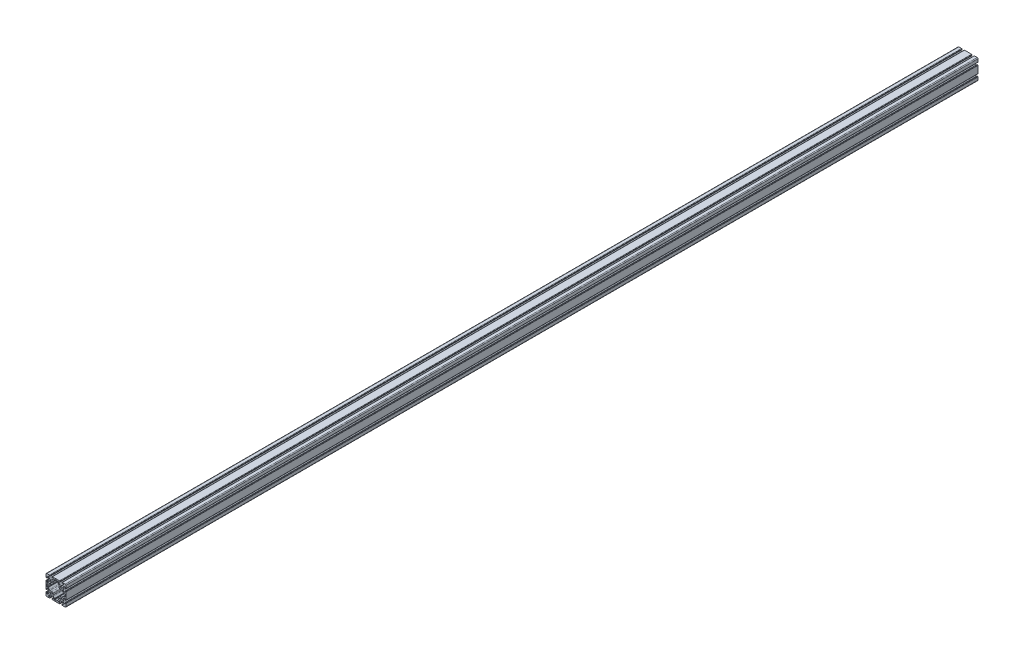
from build123d import *

# Parameters (mm, degrees)
SKETCH1_R      = 3.4
EXTRUDE1_DEPTH = 3657.6


with BuildPart() as part:
    # Sketch1 → Extrude1 (new body)
    with BuildSketch(Plane.XY):
        with BuildLine():
            Line((29.091242789, 26.036541495), (33.082657296, 30.027956002))
            ThreePointArc((33.082657296, 30.027956002), (33.329219041, 30.192703293), (33.62005845, 30.250554848))
            Line((33.62005845, 30.250554848), (33.955571436, 30.250554848))
            ThreePointArc((33.955571436, 30.250554848), (35.065729082, 29.790712494), (35.525571436, 28.680554848))
            Line((35.525571436, 28.680554848), (35.525571436, 25.777866899))
            ThreePointArc((35.525571436, 25.777866899), (35.985413789, 24.667709253), (37.095571436, 24.207866899))
            Line((37.095571436, 24.207866899), (38.43, 24.207866899))
            ThreePointArc((38.43, 24.207866899), (39.540157646, 24.667709253), (40, 25.777866899))
            Line((40, 25.777866899), (40, 32.933852749))
            Line((40, 32.933852749), (40, 36.83))
            ThreePointArc((40, 36.83), (39.071528496, 39.071528496), (36.83, 40))
            Line((36.83, 40), (25.540851266, 40))
            ThreePointArc((25.540851266, 40), (24.43069362, 39.540157646), (23.970851266, 38.43))
            Line((23.970851266, 38.43), (23.970851266, 37.249043598))
            ThreePointArc((23.970851266, 37.249043598), (24.43069362, 36.138885952), (25.540851266, 35.679043598))
            Line((25.540851266, 35.679043598), (28.625762638, 35.679043598))
            ThreePointArc((28.625762638, 35.679043598), (29.77116849, 35.239363487), (30.250554848, 34.11))
            Line((30.250554848, 34.11), (30.250554848, 33.62005845))
            ThreePointArc((30.250554848, 33.62005845), (30.192703293, 33.329219041), (30.027956002, 33.082657296))
            Line((30.027956002, 33.082657296), (26.036541495, 29.091242789))
            ThreePointArc((26.036541495, 29.091242789), (24.495530588, 28.061572221), (22.677784284, 27.7))
            Line((22.677784284, 27.7), (17.322215716, 27.7))
            ThreePointArc((17.322215716, 27.7), (15.504469412, 28.061572221), (13.963458505, 29.091242789))
            Line((13.963458505, 29.091242789), (9.90393336, 33.150767934))
            ThreePointArc((9.90393336, 33.150767934), (9.764102181, 33.360040084), (9.715, 33.606893415))
            Line((9.715, 33.606893415), (9.715, 34.096834965))
            ThreePointArc((9.715, 34.096834965), (10.178698303, 35.216301697), (11.298165035, 35.68))
            Line((11.298165035, 35.68), (14.642754087, 35.68))
            ThreePointArc((14.642754087, 35.68), (15.560045469, 36.059954531), (15.94, 36.977245913))
            Line((15.94, 36.977245913), (15.94, 38.194841282))
            ThreePointArc((15.94, 38.194841282), (15.411281253, 39.471281253), (14.134841282, 40))
            Line((14.134841282, 40), (6.984433948, 40))
            Line((6.984433948, 40), (-6.984433948, 40))
            Line((-6.984433948, 40), (-14.134841282, 40))
            ThreePointArc((-14.134841282, 40), (-15.411281253, 39.471281253), (-15.94, 38.194841282))
            Line((-15.94, 38.194841282), (-15.94, 36.977245913))
            ThreePointArc((-15.94, 36.977245913), (-15.560045469, 36.059954531), (-14.642754087, 35.68))
            Line((-14.642754087, 35.68), (-11.298165035, 35.68))
            ThreePointArc((-11.298165035, 35.68), (-10.178698303, 35.216301697), (-9.715, 34.096834965))
            Line((-9.715, 34.096834965), (-9.715, 33.606893415))
            ThreePointArc((-9.715, 33.606893415), (-9.764102181, 33.360040084), (-9.90393336, 33.150767934))
            Line((-9.90393336, 33.150767934), (-13.963458505, 29.091242789))
            ThreePointArc((-13.963458505, 29.091242789), (-15.504469412, 28.061572221), (-17.322215716, 27.7))
            Line((-17.322215716, 27.7), (-22.677784284, 27.7))
            ThreePointArc((-22.677784284, 27.7), (-24.495530588, 28.061572221), (-26.036541495, 29.091242789))
            Line((-26.036541495, 29.091242789), (-30.09606664, 33.150767934))
            ThreePointArc((-30.09606664, 33.150767934), (-30.235897819, 33.360040084), (-30.285, 33.606893415))
            Line((-30.285, 33.606893415), (-30.285, 34.096834965))
            ThreePointArc((-30.285, 34.096834965), (-29.821301697, 35.216301697), (-28.701834965, 35.68))
            Line((-28.701834965, 35.68), (-25.357245913, 35.68))
            ThreePointArc((-25.357245913, 35.68), (-24.439954531, 36.059954531), (-24.06, 36.977245913))
            Line((-24.06, 36.977245913), (-24.06, 38.194841282))
            ThreePointArc((-24.06, 38.194841282), (-24.588718747, 39.471281253), (-25.865158718, 40))
            Line((-25.865158718, 40), (-33.031395847, 40))
            Line((-33.031395847, 40), (-36.83, 40))
            ThreePointArc((-36.83, 40), (-39.071528496, 39.071528496), (-40, 36.83))
            Line((-40, 36.83), (-40, 33.318079463))
            Line((-40, 33.318079463), (-40, 25.865158718))
            ThreePointArc((-40, 25.865158718), (-39.471281253, 24.588718747), (-38.194841282, 24.06))
            Line((-38.194841282, 24.06), (-36.977245913, 24.06))
            ThreePointArc((-36.977245913, 24.06), (-36.059954531, 24.439954531), (-35.68, 25.357245913))
            Line((-35.68, 25.357245913), (-35.68, 28.680554848))
            ThreePointArc((-35.68, 28.680554848), (-35.220157646, 29.790712494), (-34.11, 30.250554848))
            Line((-34.11, 30.250554848), (-33.62005845, 30.250554848))
            ThreePointArc((-33.62005845, 30.250554848), (-33.329219041, 30.192703293), (-33.082657296, 30.027956002))
            Line((-33.082657296, 30.027956002), (-29.091242789, 26.036541495))
            ThreePointArc((-29.091242789, 26.036541495), (-28.061572221, 24.495530588), (-27.7, 22.677784284))
            Line((-27.7, 22.677784284), (-27.7, 17.322215716))
            ThreePointArc((-27.7, 17.322215716), (-28.061572221, 15.504469412), (-29.091242789, 13.963458505))
            Line((-29.091242789, 13.963458505), (-33.082657296, 9.972043998))
            ThreePointArc((-33.082657296, 9.972043998), (-33.329219041, 9.807296707), (-33.62005845, 9.749445152))
            Line((-33.62005845, 9.749445152), (-34.11, 9.749445152))
            ThreePointArc((-34.11, 9.749445152), (-35.220157646, 10.209287506), (-35.68, 11.319445152))
            Line((-35.68, 11.319445152), (-35.68, 14.642754087))
            ThreePointArc((-35.68, 14.642754087), (-36.059954531, 15.560045469), (-36.977245913, 15.94))
            Line((-36.977245913, 15.94), (-38.194841282, 15.94))
            ThreePointArc((-38.194841282, 15.94), (-39.471281253, 15.411281253), (-40, 14.134841282))
            Line((-40, 14.134841282), (-40, 7.016888977))
            Line((-40, 7.016888977), (-40, -7.016888977))
            Line((-40, -7.016888977), (-40, -14.447338303))
            ThreePointArc((-40, -14.447338303), (-39.540157646, -15.557495949), (-38.43, -16.017338303))
            Line((-38.43, -16.017338303), (-37.25, -16.017338303))
            ThreePointArc((-37.25, -16.017338303), (-36.139842354, -15.557495949), (-35.68, -14.447338303))
            Line((-35.68, -14.447338303), (-35.68, -11.319445152))
            ThreePointArc((-35.68, -11.319445152), (-35.220157646, -10.209287506), (-34.11, -9.749445152))
            Line((-34.11, -9.749445152), (-33.62005845, -9.749445152))
            ThreePointArc((-33.62005845, -9.749445152), (-33.329219041, -9.807296707), (-33.082657296, -9.972043998))
            Line((-33.082657296, -9.972043998), (-29.091242789, -13.963458505))
            ThreePointArc((-29.091242789, -13.963458505), (-28.061572221, -15.504469412), (-27.7, -17.322215716))
            Line((-27.7, -17.322215716), (-27.7, -22.677784284))
            ThreePointArc((-27.7, -22.677784284), (-28.061572221, -24.495530588), (-29.091242789, -26.036541495))
            Line((-29.091242789, -26.036541495), (-32.871776968, -29.817075674))
            ThreePointArc((-32.871776968, -29.817075674), (-33.10612883, -29.976640176), (-33.382654504, -30.039211548))
            Line((-33.382654504, -30.039211548), (-34.05520779, -30.062697627))
            ThreePointArc((-34.05520779, -30.062697627), (-35.200613642, -29.623017515), (-35.68, -28.493654028))
            Line((-35.68, -28.493654028), (-35.68, -25.59096608))
            ThreePointArc((-35.68, -25.59096608), (-36.139842354, -24.480808433), (-37.25, -24.02096608))
            Line((-37.25, -24.02096608), (-38.43, -24.02096608))
            ThreePointArc((-38.43, -24.02096608), (-39.540157646, -24.480808433), (-40, -25.59096608))
            Line((-40, -25.59096608), (-40, -33.019082273))
            Line((-40, -33.019082273), (-40, -36.83))
            ThreePointArc((-40, -36.83), (-39.071528496, -39.071528496), (-36.83, -40))
            Line((-36.83, -40), (-33, -40))
            Line((-33, -40), (-25.72307469, -40))
            ThreePointArc((-25.72307469, -40), (-24.612917043, -39.540157646), (-24.15307469, -38.43))
            Line((-24.15307469, -38.43), (-24.15307469, -37.25))
            ThreePointArc((-24.15307469, -37.25), (-24.612917043, -36.139842354), (-25.72307469, -35.68))
            Line((-25.72307469, -35.68), (-28.680554848, -35.68))
            ThreePointArc((-28.680554848, -35.68), (-29.790712494, -35.220157646), (-30.250554848, -34.11))
            Line((-30.250554848, -34.11), (-30.250554848, -33.62005845))
            ThreePointArc((-30.250554848, -33.62005845), (-30.192703293, -33.329219041), (-30.027956002, -33.082657296))
            Line((-30.027956002, -33.082657296), (-26.036541495, -29.091242789))
            ThreePointArc((-26.036541495, -29.091242789), (-24.495530588, -28.061572221), (-22.677784284, -27.7))
            Line((-22.677784284, -27.7), (-17.322215716, -27.7))
            ThreePointArc((-17.322215716, -27.7), (-15.504469412, -28.061572221), (-13.963458505, -29.091242789))
            Line((-13.963458505, -29.091242789), (-10.203784275, -32.85091702))
            ThreePointArc((-10.203784275, -32.85091702), (-10.044219772, -33.085268882), (-9.9816484, -33.361794556))
            Line((-9.9816484, -33.361794556), (-9.957433876, -34.05520779))
            ThreePointArc((-9.957433876, -34.05520779), (-10.397113988, -35.200613642), (-11.526477474, -35.68))
            Line((-11.526477474, -35.68), (-14.429165423, -35.68))
            ThreePointArc((-14.429165423, -35.68), (-15.539323069, -36.139842354), (-15.999165423, -37.25))
            Line((-15.999165423, -37.25), (-15.999165423, -38.43))
            ThreePointArc((-15.999165423, -38.43), (-15.539323069, -39.540157646), (-14.429165423, -40))
            Line((-14.429165423, -40), (-6.998716097, -40))
            Line((-6.998716097, -40), (6.998716097, -40))
            Line((6.998716097, -40), (14.424638994, -40))
            ThreePointArc((14.424638994, -40), (15.53479664, -39.540157646), (15.994638994, -38.43))
            Line((15.994638994, -38.43), (15.994638994, -37.032644306))
            ThreePointArc((15.994638994, -37.032644306), (15.53479664, -35.922486659), (14.424638994, -35.462644306))
            Line((14.424638994, -35.462644306), (11.382372282, -35.462644306))
            ThreePointArc((11.382372282, -35.462644306), (10.272214636, -35.002801952), (9.812372282, -33.892644306))
            Line((9.812372282, -33.892644306), (9.812372282, -33.55713132))
            ThreePointArc((9.812372282, -33.55713132), (9.870223837, -33.266291912), (10.034971128, -33.019730166))
            Line((10.034971128, -33.019730166), (13.963458505, -29.091242789))
            ThreePointArc((13.963458505, -29.091242789), (15.504469412, -28.061572221), (17.322215716, -27.7))
            Line((17.322215716, -27.7), (22.677784284, -27.7))
            ThreePointArc((22.677784284, -27.7), (24.495530588, -28.061572221), (26.036541495, -29.091242789))
            Line((26.036541495, -29.091242789), (29.794925243, -32.849626538))
            ThreePointArc((29.794925243, -32.849626538), (29.954489746, -33.083978399), (30.017061118, -33.360504074))
            Line((30.017061118, -33.360504074), (30.041320706, -34.05520779))
            ThreePointArc((30.041320706, -34.05520779), (29.601640594, -35.200613642), (28.472277108, -35.68))
            Line((28.472277108, -35.68), (25.569589159, -35.68))
            ThreePointArc((25.569589159, -35.68), (24.459431513, -36.139842354), (23.999589159, -37.25))
            Line((23.999589159, -37.25), (23.999589159, -38.43))
            ThreePointArc((23.999589159, -38.43), (24.459431513, -39.540157646), (25.569589159, -40))
            Line((25.569589159, -40), (32.999849358, -40))
            Line((32.999849358, -40), (36.83, -40))
            ThreePointArc((36.83, -40), (39.071528496, -39.071528496), (40, -36.83))
            Line((40, -36.83), (40, -33.025941835))
            Line((40, -33.025941835), (40, -25.777866899))
            ThreePointArc((40, -25.777866899), (39.540157646, -24.667709253), (38.43, -24.207866899))
            Line((38.43, -24.207866899), (37.25, -24.207866899))
            ThreePointArc((37.25, -24.207866899), (36.139842354, -24.667709253), (35.68, -25.777866899))
            Line((35.68, -25.777866899), (35.68, -28.680554848))
            ThreePointArc((35.68, -28.680554848), (35.220157646, -29.790712494), (34.11, -30.250554848))
            Line((34.11, -30.250554848), (33.62005845, -30.250554848))
            ThreePointArc((33.62005845, -30.250554848), (33.329219041, -30.192703293), (33.082657296, -30.027956002))
            Line((33.082657296, -30.027956002), (29.091242789, -26.036541495))
            ThreePointArc((29.091242789, -26.036541495), (28.061572221, -24.495530588), (27.7, -22.677784284))
            Line((27.7, -22.677784284), (27.7, -17.322215716))
            ThreePointArc((27.7, -17.322215716), (28.061572221, -15.504469412), (29.091242789, -13.963458505))
            Line((29.091242789, -13.963458505), (33.082657296, -9.972043998))
            ThreePointArc((33.082657296, -9.972043998), (33.329219041, -9.807296707), (33.62005845, -9.749445152))
            Line((33.62005845, -9.749445152), (34.11, -9.749445152))
            ThreePointArc((34.11, -9.749445152), (35.220157646, -10.209287506), (35.68, -11.319445152))
            Line((35.68, -11.319445152), (35.68, -14.222133101))
            ThreePointArc((35.68, -14.222133101), (36.139842354, -15.332290747), (37.25, -15.792133101))
            Line((37.25, -15.792133101), (38.43, -15.792133101))
            ThreePointArc((38.43, -15.792133101), (39.540157646, -15.332290747), (40, -14.222133101))
            Line((40, -14.222133101), (40, -7.021415406))
            Line((40, -7.021415406), (40, 7.021415406))
            Line((40, 7.021415406), (40, 14.222133101))
            ThreePointArc((40, 14.222133101), (39.540157646, 15.332290747), (38.43, 15.792133101))
            Line((38.43, 15.792133101), (37.25, 15.792133101))
            ThreePointArc((37.25, 15.792133101), (36.139842354, 15.332290747), (35.68, 14.222133101))
            Line((35.68, 14.222133101), (35.68, 11.319445152))
            ThreePointArc((35.68, 11.319445152), (35.220157646, 10.209287506), (34.11, 9.749445152))
            Line((34.11, 9.749445152), (33.62005845, 9.749445152))
            ThreePointArc((33.62005845, 9.749445152), (33.329219041, 9.807296707), (33.082657296, 9.972043998))
            Line((33.082657296, 9.972043998), (29.091242789, 13.963458505))
            ThreePointArc((29.091242789, 13.963458505), (28.061572221, 15.504469412), (27.7, 17.322215716))
            Line((27.7, 17.322215716), (27.7, 22.677784284))
            ThreePointArc((27.7, 22.677784284), (28.061572221, 24.495530588), (29.091242789, 26.036541495))
        make_face()
        with Locations((-20, 20)):
            Circle(SKETCH1_R, mode=Mode.SUBTRACT)
        with Locations((20, 20)):
            Circle(SKETCH1_R, mode=Mode.SUBTRACT)
        with Locations((20, -20)):
            Circle(SKETCH1_R, mode=Mode.SUBTRACT)
        with Locations((-20, -20)):
            Circle(SKETCH1_R, mode=Mode.SUBTRACT)
        with BuildLine():
            Line((17.07, 12.32), (22.657784284, 12.32))
            ThreePointArc((22.657784284, 12.32), (24.475530588, 11.958427779), (26.016541495, 10.928757211))
            Line((26.016541495, 10.928757211), (31.143879165, 5.80141954))
            ThreePointArc((31.143879165, 5.80141954), (31.555896818, 5.526118146), (32.041904777, 5.429445152))
            Line((32.041904777, 5.429445152), (34.41, 5.429445152))
            ThreePointArc((34.41, 5.429445152), (35.308025612, 5.057470764), (35.68, 4.159445152))
            Line((35.68, 4.159445152), (35.68, -4.159445152))
            ThreePointArc((35.68, -4.159445152), (35.308025612, -5.057470764), (34.41, -5.429445152))
            Line((34.41, -5.429445152), (32.041904777, -5.429445152))
            ThreePointArc((32.041904777, -5.429445152), (31.555896818, -5.526118146), (31.143879165, -5.80141954))
            Line((31.143879165, -5.80141954), (26.016541495, -10.928757211))
            ThreePointArc((26.016541495, -10.928757211), (24.475530588, -11.958427779), (22.657784284, -12.32))
            Line((22.657784284, -12.32), (17.07, -12.32))
            ThreePointArc((17.07, -12.32), (13.711242789, -13.711242789), (12.32, -17.07))
            Line((12.32, -17.07), (12.32, -22.657784284))
            ThreePointArc((12.32, -22.657784284), (11.958427779, -24.475530588), (10.928757211, -26.016541495))
            Line((10.928757211, -26.016541495), (5.80141954, -31.143879165))
            ThreePointArc((5.80141954, -31.143879165), (5.526118146, -31.555896818), (5.429445152, -32.041904777))
            Line((5.429445152, -32.041904777), (5.429445152, -34.41))
            ThreePointArc((5.429445152, -34.41), (5.057470764, -35.308025612), (4.159445152, -35.68))
            Line((4.159445152, -35.68), (-4.159445152, -35.68))
            ThreePointArc((-4.159445152, -35.68), (-5.057470764, -35.308025612), (-5.429445152, -34.41))
            Line((-5.429445152, -34.41), (-5.429445152, -32.041904777))
            ThreePointArc((-5.429445152, -32.041904777), (-5.526118146, -31.555896818), (-5.80141954, -31.143879165))
            Line((-5.80141954, -31.143879165), (-10.928757211, -26.016541495))
            ThreePointArc((-10.928757211, -26.016541495), (-11.958427779, -24.475530588), (-12.32, -22.657784284))
            Line((-12.32, -22.657784284), (-12.32, -17.07))
            ThreePointArc((-12.32, -17.07), (-13.711242789, -13.711242789), (-17.07, -12.32))
            Line((-17.07, -12.32), (-22.657784284, -12.32))
            ThreePointArc((-22.657784284, -12.32), (-24.475530588, -11.958427779), (-26.016541495, -10.928757211))
            Line((-26.016541495, -10.928757211), (-31.143879165, -5.80141954))
            ThreePointArc((-31.143879165, -5.80141954), (-31.555896818, -5.526118146), (-32.041904777, -5.429445152))
            Line((-32.041904777, -5.429445152), (-34.41, -5.429445152))
            ThreePointArc((-34.41, -5.429445152), (-35.308025612, -5.057470764), (-35.68, -4.159445152))
            Line((-35.68, -4.159445152), (-35.68, 4.159445152))
            ThreePointArc((-35.68, 4.159445152), (-35.308025612, 5.057470764), (-34.41, 5.429445152))
            Line((-34.41, 5.429445152), (-32.041904777, 5.429445152))
            ThreePointArc((-32.041904777, 5.429445152), (-31.555896818, 5.526118146), (-31.143879165, 5.80141954))
            Line((-31.143879165, 5.80141954), (-26.016541495, 10.928757211))
            ThreePointArc((-26.016541495, 10.928757211), (-24.475530588, 11.958427779), (-22.657784284, 12.32))
            Line((-22.657784284, 12.32), (-17.07, 12.32))
            ThreePointArc((-17.07, 12.32), (-13.711242789, 13.711242789), (-12.32, 17.07))
            Line((-12.32, 17.07), (-12.32, 22.657784284))
            ThreePointArc((-12.32, 22.657784284), (-11.958427779, 24.475530588), (-10.928757211, 26.016541495))
            Line((-10.928757211, 26.016541495), (-5.80141954, 31.143879165))
            ThreePointArc((-5.80141954, 31.143879165), (-5.526118146, 31.555896818), (-5.429445152, 32.041904777))
            Line((-5.429445152, 32.041904777), (-5.429445152, 34.41))
            ThreePointArc((-5.429445152, 34.41), (-5.057470764, 35.308025612), (-4.159445152, 35.68))
            Line((-4.159445152, 35.68), (4.159445152, 35.68))
            ThreePointArc((4.159445152, 35.68), (5.057470764, 35.308025612), (5.429445152, 34.41))
            Line((5.429445152, 34.41), (5.429445152, 32.041904777))
            ThreePointArc((5.429445152, 32.041904777), (5.526118146, 31.555896818), (5.80141954, 31.143879165))
            Line((5.80141954, 31.143879165), (10.928757211, 26.016541495))
            ThreePointArc((10.928757211, 26.016541495), (11.958427779, 24.475530588), (12.32, 22.657784284))
            Line((12.32, 22.657784284), (12.32, 17.07))
            ThreePointArc((12.32, 17.07), (13.711242789, 13.711242789), (17.07, 12.32))
        make_face(mode=Mode.SUBTRACT)
    extrude(amount=-EXTRUDE1_DEPTH)


solid = part.part
